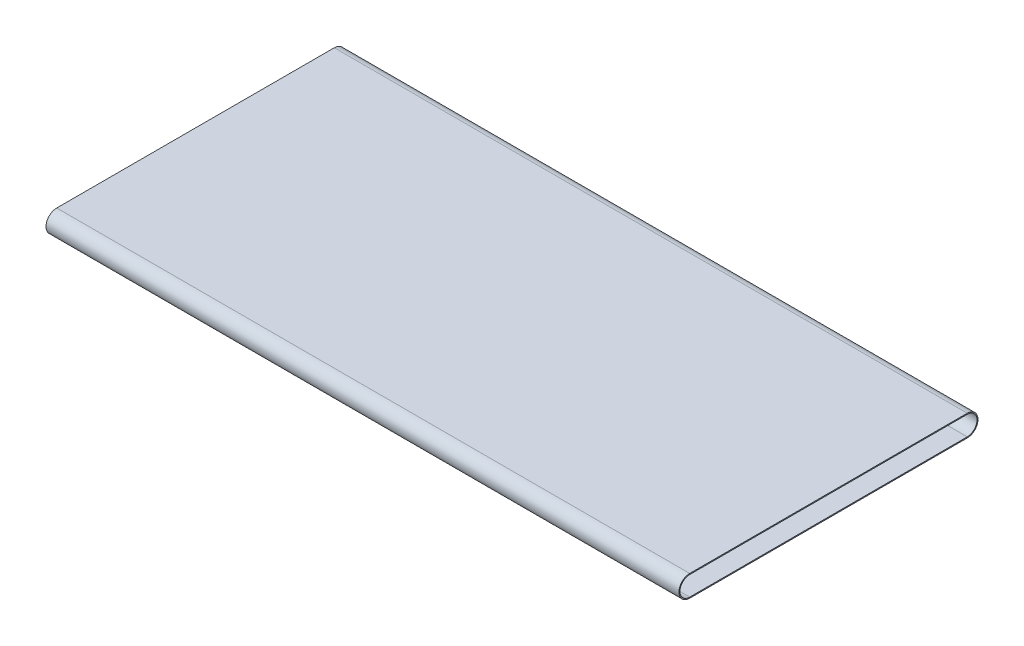
from build123d import *

# Parameters (mm, degrees)
BOSS_EXTRUDE1_DEPTH = 3962.4


with BuildPart() as part:
    # Sketch1 → Boss-Extrude1 (new body)
    with BuildSketch(Plane(origin=(0, 0, 0), x_dir=(0, 0, -1), z_dir=(1, 0, 0))):
        with BuildLine():
            Line((0, -67.31), (-1737.36, -67.31))
            ThreePointArc((-1737.36, -67.31), (-1804.67, 0), (-1737.36, 67.31))
            Line((-1737.36, 67.31), (0, 67.31))
            ThreePointArc((0, 67.31), (67.31, 0), (0, -67.31))
        make_face()
        with BuildLine():
            Line((0, -60.96), (-1737.36, -60.96))
            ThreePointArc((-1737.36, -60.96), (-1798.32, 0), (-1737.36, 60.96))
            Line((-1737.36, 60.96), (0, 60.96))
            ThreePointArc((0, 60.96), (60.96, 0), (0, -60.96))
        make_face(mode=Mode.SUBTRACT)
    extrude(amount=BOSS_EXTRUDE1_DEPTH)


solid = part.part
